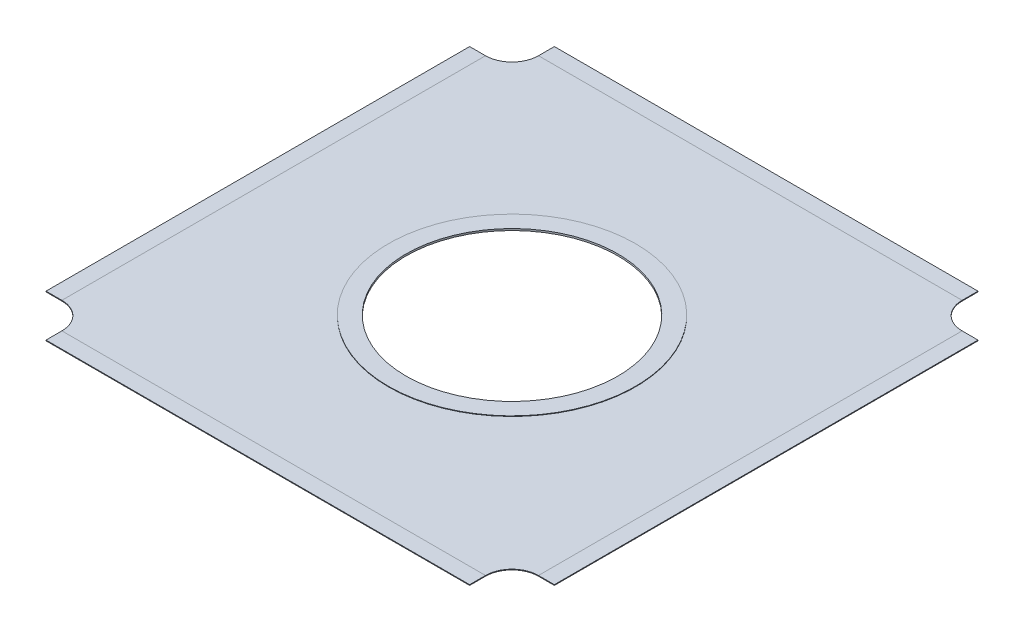
from build123d import *

# Parameters (mm, degrees)
SKETCH1_R           = 88.9
BOSS_EXTRUDE1_DEPTH = 0.254
SKETCH1_4_R         = 88.9
SKETCH1_4_R_2       = 76.2
BOSS_EXTRUDE2_DEPTH = 0.635


with BuildPart() as part:
    # Sketch1 → Boss-Extrude1 (new, symmetric)
    with BuildSketch(Plane(origin=(0, 0, 0), x_dir=(1, 0, 0), z_dir=(0, 1, 0))):
        with BuildLine():
            ThreePointArc((-171.45, -152.4), (-157.979615818, -157.979615818), (-152.4, -171.45))
            Line((-152.4, -171.45), (-152.4, -182.88))
            Line((-152.4, -182.88), (152.4, -182.88))
            Line((152.4, -182.88), (152.4, -171.45))
            ThreePointArc((152.4, -171.45), (157.979615818, -157.979615818), (171.45, -152.4))
            Line((171.45, -152.4), (182.88, -152.4))
            Line((182.88, -152.4), (182.88, 152.4))
            Line((182.88, 152.4), (171.45, 152.4))
            ThreePointArc((171.45, 152.4), (157.979615818, 157.979615818), (152.4, 171.45))
            Line((152.4, 171.45), (152.4, 182.88))
            Line((152.4, 182.88), (-152.4, 182.88))
            Line((-152.4, 182.88), (-152.4, 171.45))
            ThreePointArc((-152.4, 171.45), (-157.979615818, 157.979615818), (-171.45, 152.4))
            Line((-171.45, 152.4), (-182.88, 152.4))
            Line((-182.88, 152.4), (-182.88, -152.4))
            Line((-182.88, -152.4), (-171.45, -152.4))
        make_face()
        Circle(SKETCH1_R, mode=Mode.SUBTRACT)
    extrude(amount=BOSS_EXTRUDE1_DEPTH, both=True)


with BuildPart() as body_2:
    # Sketch1<4> → Boss-Extrude2 (new, symmetric)
    with BuildSketch(Plane(origin=(0, 0, 0), x_dir=(1, 0, 0), z_dir=(0, 1, 0))):
        Circle(SKETCH1_4_R)
        Circle(SKETCH1_4_R_2, mode=Mode.SUBTRACT)
    extrude(amount=BOSS_EXTRUDE2_DEPTH, both=True)


solid = Compound([part.part, body_2.part])
